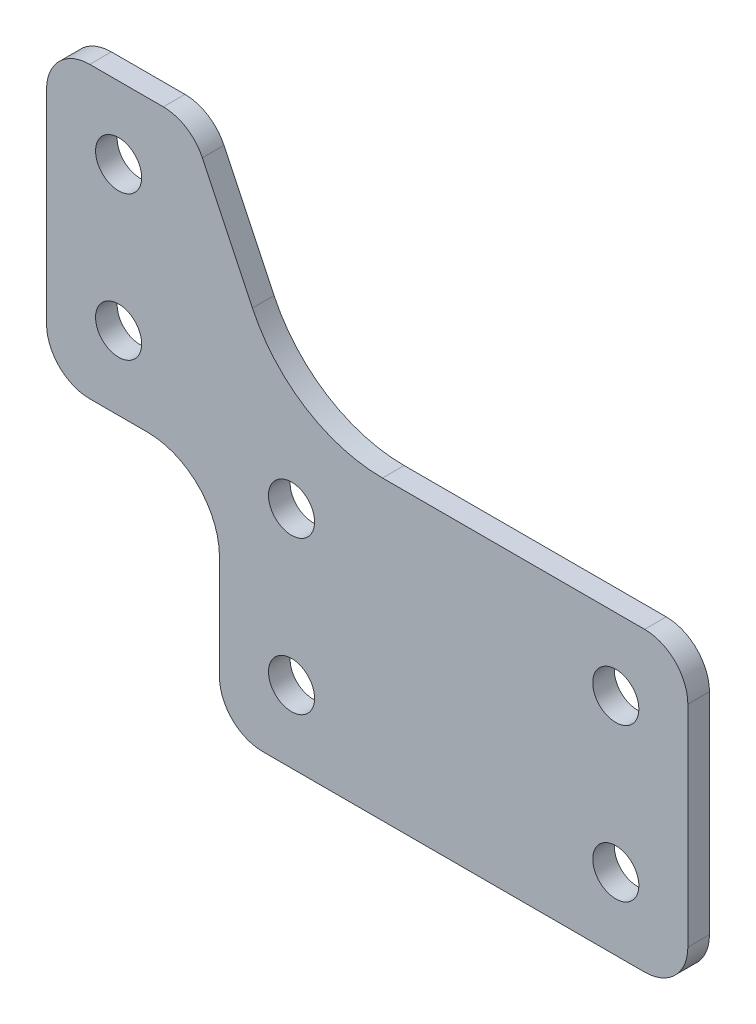
from build123d import *

# Parameters (mm, degrees)
SKETCH_1_R      = 1.6
EXTRUDE_1_DEPTH = 1.5
FILLET_5_R      = 3
FILLET_6_R      = 5
FILLET_8_R      = 10


with BuildPart() as part:
    # ｽｹｯﾁ1 → ﾎﾞｽ - 押し出し1 (new body)
    with BuildSketch(Plane.XY):
        Polygon((16.25, -10.3), (16.25, 10.3), (-11.25, 10.3), (-18.25, 25), (-28.25, 25), (-28.25, 4.9), (-16.25, 4.9), (-16.25, -10.3), align=None)
        with Locations((-11.25, -5.3)):
            Circle(SKETCH_1_R, mode=Mode.SUBTRACT)
        with Locations((11.25, -5.3)):
            Circle(SKETCH_1_R, mode=Mode.SUBTRACT)
        with Locations((-11.25, 5.3)):
            Circle(SKETCH_1_R, mode=Mode.SUBTRACT)
        with Locations((11.25, 5.3)):
            Circle(SKETCH_1_R, mode=Mode.SUBTRACT)
        with Locations((-23.25, 20)):
            Circle(SKETCH_1_R, mode=Mode.SUBTRACT)
        with Locations((-23.25, 10)):
            Circle(SKETCH_1_R, mode=Mode.SUBTRACT)
    extrude(amount=EXTRUDE_1_DEPTH)

    # ﾌｨﾚｯﾄ5
    fillet_5_edges = [part.edges().sort_by_distance(p)[0] for p in [
        (-28.25, 4.9, 0.75),
        (-28.25, 25, 0.75),
        (-18.25, 25, 0.75),
        (16.25, 10.3, 0.75),
        (16.25, -10.3, 0.75),
        (-16.25, -10.3, 0.75),
    ]]
    fillet(fillet_5_edges, radius=FILLET_5_R)

    # ﾌｨﾚｯﾄ6
    fillet_6_edges = [part.edges().sort_by_distance(p)[0] for p in [
        (-16.25, 4.9, 0.75),
    ]]
    fillet(fillet_6_edges, radius=FILLET_6_R)

    # ﾌｨﾚｯﾄ8
    fillet_8_edges = [part.edges().sort_by_distance(p)[0] for p in [
        (-11.25, 10.3, 0.75),
    ]]
    fillet(fillet_8_edges, radius=FILLET_8_R)


solid = part.part
